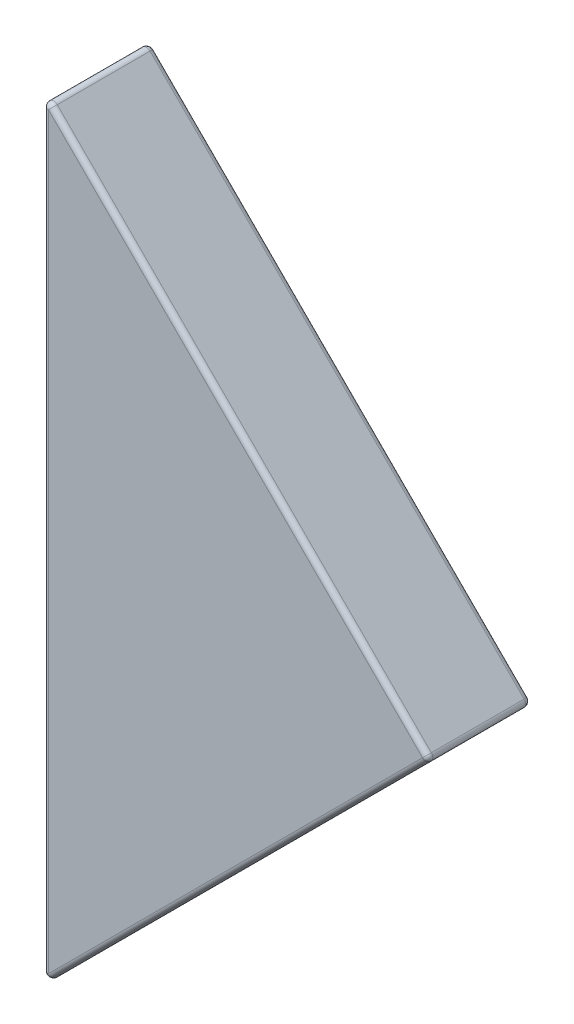
from build123d import *

# Parameters (mm, degrees)
EXTRUDE_1_DEPTH = 10
FILLET_1_R      = 0.5


with BuildPart() as part:
    # 草图1 → 凸台-拉伸1 (new body)
    with BuildSketch(Plane.XY):
        Polygon((0, 75), (37.5, 37.5), (0, 0), align=None)
    extrude(amount=EXTRUDE_1_DEPTH)

    # 圆角1
    fillet_1_edges = [part.edges().sort_by_distance(p)[0] for p in [
        (18.75, 56.25, 10),
        (18.75, 56.25, 0),
        (0, 37.5, 10),
        (18.75, 18.75, 0),
        (0, 37.5, 0),
        (0, 75, 5),
        (37.5, 37.5, 5),
        (0, 0, 5),
        (18.75, 18.75, 10),
    ]]
    fillet(fillet_1_edges, radius=FILLET_1_R)


solid = part.part
